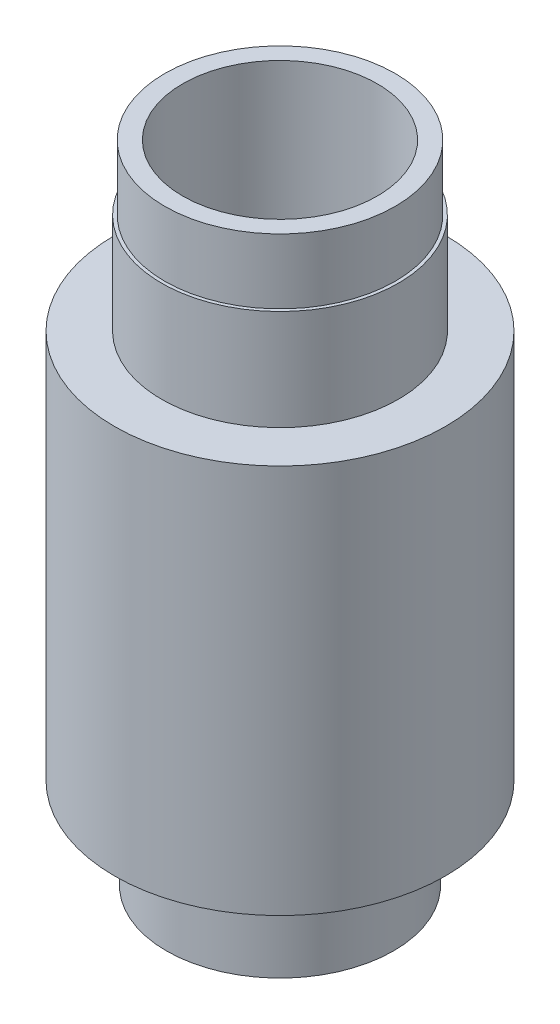
from build123d import *

# Parameters (mm, degrees)
SKETCH3_R          = 3
CUT_EXTRUDE1_DEPTH = 5


with BuildPart() as part:
    # Sketch1 → Revolve1 (revolve)
    with BuildSketch(Plane.XY, mode=Mode.PRIVATE) as revolve1_sk:
        Polygon((0, 0), (3.5, 0), (3.5, 2.8), (5.1, 2.8), (5.1, 14.8), (3.65, 14.8), (3.65, 17.9), (3.55, 17.9), (3.55, 19.9), (0, 19.9), align=None)
    revolve(revolve1_sk.sketch.rotate(Axis((0, 0, 0), (0, 1, 0)), 90), axis=Axis((0, 0, 0), (0, 1, 0)))

    # Sketch3 → Cut-Extrude1 (cut)
    with BuildSketch(Plane(origin=(0, 19.9, 0), x_dir=(1, 0, 0), z_dir=(0, 1, 0))):
        with Locations(Location((0, 0, 0), (0, 0, 270))):
            Circle(SKETCH3_R)
    extrude(amount=-CUT_EXTRUDE1_DEPTH, mode=Mode.SUBTRACT)


solid = part.part
